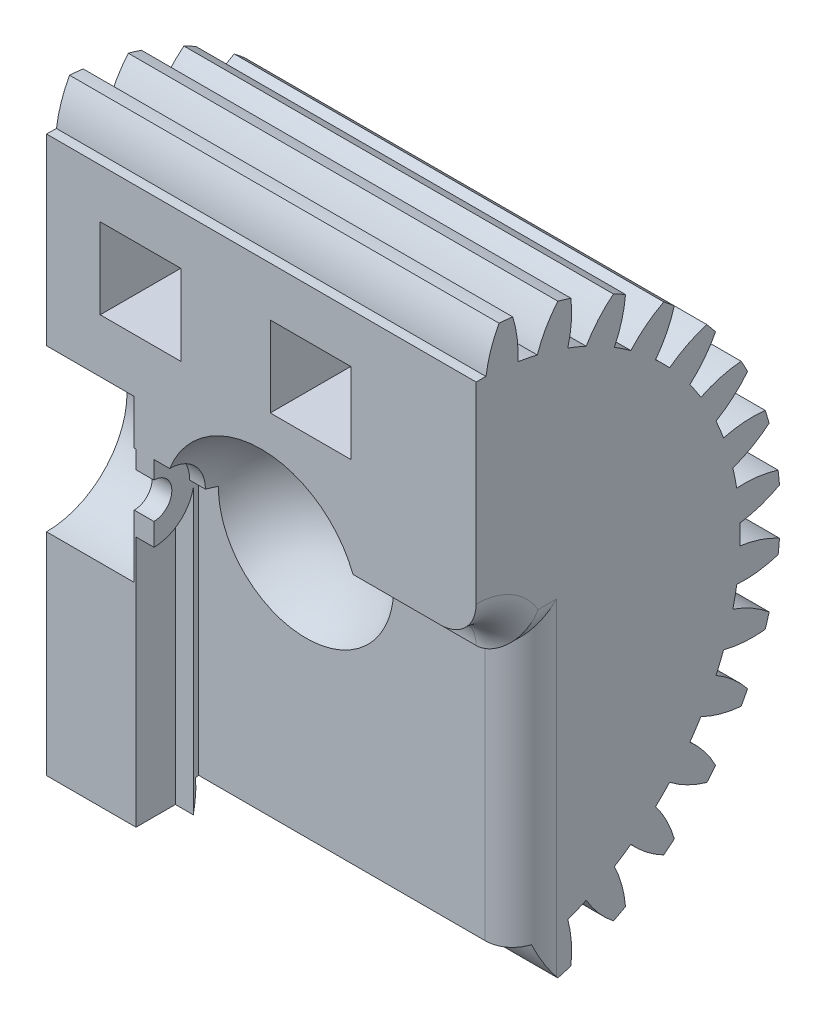
from build123d import *

# Parameters (mm, degrees)
BASPROSKE_W         = 10
BASPROSKE_H         = 8.5
TOOTHCUT_DEPTH      = 16.636495771
TEETHCUTS_COUNT     = 32
TEETHCUTS_ANGLE     = 348.75
BORSKE_R            = 1
BORE_DEPTH          = 50.0000508
SKETCH1_W           = 2.2
SKETCH1_H           = 12
CUT_EXTRUDE1_DEPTH  = 16.610070769
SKETCH4_R           = 1.125
SKETCH4_R_2         = 0.5
BOSS_EXTRUDE1_DEPTH = 0.5
BOSS_EXTRUDE2_REACH = 18.234
SKETCH5_W           = 2.5
SKETCH5_H           = 8.148803967
SKETCH6_R           = 2.25
CUT_EXTRUDE4_DEPTH  = 2.45
SKETCH7_R           = 0.5
CUT_EXTRUDE5_DEPTH  = 2.4
SKETCH8_W           = 11.062945953
SKETCH8_H           = 17.798852561
CUT_EXTRUDE7_DEPTH  = 10
SKETCH9_W           = 2.25
SKETCH9_H           = 2.25
CUT_EXTRUDE8_DEPTH  = 2.25
SKETCH10_W          = 1.25
SKETCH10_H          = 9
CUT_EXTRUDE10_DEPTH = 7
BOSS_EXTRUDE3_REACH = 18.961
FILLET1_R           = 1


with BuildPart() as part:
    # BasProSke → Base-Revolve (revolve)
    with BuildSketch(Plane(origin=(0, 0, 0), x_dir=(1, 0, 0), z_dir=(0, 1, 0))):
        with Locations((5, 4.25)):
            Rectangle(BASPROSKE_W, BASPROSKE_H)
    revolve(axis=Axis((-10, 0, 0), (1, 0, 0)))

    # TooCutSke → ToothCut (cut, through all)
    with BuildSketch(Plane(origin=(0, 0, 0), x_dir=(0, 0, -1), z_dir=(1, 0, 0))):
        with BuildLine():
            ThreePointArc((0.277002447, 7.3687954), (0, 7.374), (-0.277002447, 7.3687954))
            ThreePointArc((-0.277002447, 7.3687954), (-0.41335061, 7.952280695), (-0.656086882, 8.500117362))
            ThreePointArc((-0.656086882, 8.500117362), (0, 8.5254), (0.656086882, 8.500117362))
            ThreePointArc((0.656086882, 8.500117362), (0.41335061, 7.952280695), (0.277002447, 7.3687954))
        make_face()
    toothcut = extrude(amount=TOOTHCUT_DEPTH, mode=Mode.SUBTRACT)

    # TeethCuts: ToothCut ×32 about axis
    teethcuts_axis = Axis((-10, 0, 0), (1, 0, 0))
    for i in range(1, TEETHCUTS_COUNT):
        add(toothcut.rotate(teethcuts_axis, i * TEETHCUTS_ANGLE / (TEETHCUTS_COUNT - 1)), mode=Mode.SUBTRACT)

    # BorSke → Bore (cut, symmetric)
    with BuildSketch(Plane(origin=(0, 0, 0), x_dir=(0, 0, -1), z_dir=(1, 0, 0))):
        Circle(BORSKE_R)
    extrude(amount=BORE_DEPTH, both=True, mode=Mode.SUBTRACT)

    # Sketch1 → Cut-Extrude1 (cut, through all)
    with BuildSketch(Plane(origin=(10, 0, 0), x_dir=(0, 0, -1), z_dir=(1, 0, 0))):
        with Locations((0, -6)):
            Rectangle(SKETCH1_W, SKETCH1_H)
    extrude(amount=-CUT_EXTRUDE1_DEPTH, mode=Mode.SUBTRACT)

    # Sketch2 → Cut-Revolve1 (revolve, cut)
    with BuildSketch(Plane.XY):
        with BuildLine():
            Line((3.25, 0), (8.75, 0))
            ThreePointArc((8.75, 0), (6, 2.75), (3.25, 0))
        make_face()
    revolve(axis=Axis((3.25, 0, 0), (1, 0, 0)), mode=Mode.SUBTRACT)

    # Sketch4 → Boss-Extrude1 (add)
    with BuildSketch(Plane.ZY.offset(-3)):
        Circle(SKETCH4_R)
        Circle(SKETCH4_R_2, mode=Mode.SUBTRACT)
    extrude(amount=BOSS_EXTRUDE1_DEPTH)

    # Sketch5 → Boss-Extrude2 (add, up to next)
    with BuildSketch(Plane.XY.offset(-1.1), mode=Mode.PRIVATE) as boss_extrude2_sk1:
        with Locations((1.25, -4.074401984)):
            Rectangle(SKETCH5_W, SKETCH5_H)
    boss_extrude2_tool1 = extrude(boss_extrude2_sk1.sketch, amount=BOSS_EXTRUDE2_REACH, mode=Mode.PRIVATE) - part.part
    add(boss_extrude2_tool1.solids().sort_by_distance((1.25, -4.074402, -1.1))[0])

    # Sketch6 → Cut-Extrude4 (cut)
    with BuildSketch(Plane.ZY):
        Circle(SKETCH6_R)
    extrude(amount=-CUT_EXTRUDE4_DEPTH, mode=Mode.SUBTRACT)

    # Sketch7 → Cut-Extrude5 (cut)
    with BuildSketch(Plane(origin=(2.5, 0, 0), x_dir=(0, 0, -1), z_dir=(1, 0, 0))):
        Circle(SKETCH7_R)
    extrude(amount=-CUT_EXTRUDE5_DEPTH, mode=Mode.SUBTRACT)

    # Sketch8 → Cut-Extrude7 (cut)
    with BuildSketch(Plane.XY):
        with Locations((5.022304327, 0.010278679)):
            Rectangle(SKETCH8_W, SKETCH8_H)
    extrude(amount=CUT_EXTRUDE7_DEPTH, mode=Mode.SUBTRACT)

    # Sketch9 → Cut-Extrude8 (cut)
    with BuildSketch(Plane.XY):
        with Locations((2.625, 4.875)):
            Rectangle(SKETCH9_W, SKETCH9_H)
        with Locations((7.375, 4.875)):
            Rectangle(SKETCH9_W, SKETCH9_H)
    extrude(amount=-CUT_EXTRUDE8_DEPTH, mode=Mode.SUBTRACT)

    # Sketch10 → Cut-Extrude10 (cut)
    with BuildSketch(Plane(origin=(10, 0, 0), x_dir=(0, 0, -1), z_dir=(1, 0, 0))):
        with Locations((0.625, -4.5)):
            Rectangle(SKETCH10_W, SKETCH10_H)
    extrude(amount=-CUT_EXTRUDE10_DEPTH, mode=Mode.SUBTRACT)

    # Sketch11 → Boss-Extrude3 (add, up to next)
    with BuildSketch(Plane(origin=(12, 0, 0), x_dir=(0, 0, -1), z_dir=(1, 0, 0)), mode=Mode.PRIVATE) as boss_extrude3_sk1:
        with BuildLine():
            Line((0, 1), (0, 7.374))
            ThreePointArc((0, 7.374), (0.138525669, 7.372698735), (0.277002447, 7.3687954))
            ThreePointArc((0.277002447, 7.3687954), (0.408940123, 7.939022225), (0.642530382, 8.475680191))
            ThreePointArc((0.642530382, 8.475680191), (0.833145693, 8.459070177), (1.023338837, 8.438173832))
            ThreePointArc((1.023338837, 8.438173832), (1.14774395, 7.866256399), (1.165900745, 7.281246559))
            ThreePointArc((1.165900745, 7.281246559), (1.438596035, 7.232310658), (1.70926059, 7.173165566))
            ThreePointArc((1.70926059, 7.173165566), (1.949908855, 7.706695879), (2.283707519, 8.187470914))
            ThreePointArc((2.283707519, 8.187470914), (2.467419757, 8.133992854), (2.649881718, 8.076393185))
            ThreePointArc((2.649881718, 8.076393185), (2.660320865, 7.491194752), (2.563999025, 6.913883496))
            ThreePointArc((2.563999025, 6.913883496), (2.82190763, 6.812687673), (3.075832807, 6.701875002))
            ThreePointArc((3.075832807, 6.701875002), (3.415943684, 7.178205532), (3.837123056, 7.584621721))
            ThreePointArc((3.837123056, 7.584621721), (4.006872263, 7.496330747), (4.174591131, 7.404241277))
            ThreePointArc((4.174591131, 7.404241277), (4.070663142, 6.828250691), (3.86356426, 6.280823768))
            ThreePointArc((3.86356426, 6.280823768), (4.096774898, 6.131256921), (4.324202495, 5.97303514))
            ThreePointArc((4.324202495, 5.97303514), (4.750705713, 6.373860772), (5.243080107, 6.690299769))
            ThreePointArc((5.243080107, 6.690299769), (5.392342915, 6.570588854), (5.538873348, 6.447548529))
            ThreePointArc((5.538873348, 6.447548529), (5.324572118, 5.902900785), (5.014654888, 5.406395505))
            ThreePointArc((5.014654888, 5.406395505), (5.214205404, 5.214205404), (5.406395505, 5.014654888))
            ThreePointArc((5.406395505, 5.014654888), (5.902900785, 5.324572118), (6.447548529, 5.538873348))
            ThreePointArc((6.447548529, 5.538873348), (6.570588854, 5.392342915), (6.690299769, 5.243080107))
            ThreePointArc((6.690299769, 5.243080107), (6.373860772, 4.750705713), (5.97303514, 4.324202495))
            ThreePointArc((5.97303514, 4.324202495), (6.131256921, 4.096774898), (6.280823768, 3.86356426))
            ThreePointArc((6.280823768, 3.86356426), (6.828250691, 4.070663142), (7.404241277, 4.174591131))
            ThreePointArc((7.404241277, 4.174591131), (7.496330747, 4.006872263), (7.584621721, 3.837123056))
            ThreePointArc((7.584621721, 3.837123056), (7.178205532, 3.415943684), (6.701875002, 3.075832807))
            ThreePointArc((6.701875002, 3.075832807), (6.812687673, 2.82190763), (6.913883496, 2.563999025))
            ThreePointArc((6.913883496, 2.563999025), (7.491194752, 2.660320865), (8.076393185, 2.649881718))
            ThreePointArc((8.076393185, 2.649881718), (8.133992854, 2.467419757), (8.187470914, 2.283707519))
            ThreePointArc((8.187470914, 2.283707519), (7.706695879, 1.949908855), (7.173165566, 1.70926059))
            ThreePointArc((7.173165566, 1.70926059), (7.232310658, 1.438596035), (7.281246559, 1.165900745))
            ThreePointArc((7.281246559, 1.165900745), (7.866256399, 1.14774395), (8.438173832, 1.023338837))
            ThreePointArc((8.438173832, 1.023338837), (8.459070177, 0.833145693), (8.475680191, 0.642530382))
            ThreePointArc((8.475680191, 0.642530382), (7.939022225, 0.408940123), (7.3687954, 0.277002447))
            ThreePointArc((7.3687954, 0.277002447), (7.374, 0), (7.3687954, -0.277002447))
            ThreePointArc((7.3687954, -0.277002447), (7.939022225, -0.408940123), (8.475680191, -0.642530382))
            ThreePointArc((8.475680191, -0.642530382), (8.459070177, -0.833145693), (8.438173832, -1.023338837))
            ThreePointArc((8.438173832, -1.023338837), (7.866256399, -1.14774395), (7.281246559, -1.165900745))
            ThreePointArc((7.281246559, -1.165900745), (7.232310658, -1.438596035), (7.173165566, -1.70926059))
            ThreePointArc((7.173165566, -1.70926059), (7.706695879, -1.949908855), (8.187470914, -2.283707519))
            ThreePointArc((8.187470914, -2.283707519), (8.133992854, -2.467419757), (8.076393185, -2.649881718))
            ThreePointArc((8.076393185, -2.649881718), (7.491194752, -2.660320865), (6.913883496, -2.563999025))
            ThreePointArc((6.913883496, -2.563999025), (6.812687673, -2.82190763), (6.701875002, -3.075832807))
            ThreePointArc((6.701875002, -3.075832807), (7.178205532, -3.415943684), (7.584621721, -3.837123056))
            ThreePointArc((7.584621721, -3.837123056), (7.496330747, -4.006872263), (7.404241277, -4.174591131))
            ThreePointArc((7.404241277, -4.174591131), (6.828250691, -4.070663142), (6.280823768, -3.86356426))
            ThreePointArc((6.280823768, -3.86356426), (6.131256921, -4.096774898), (5.97303514, -4.324202495))
            ThreePointArc((5.97303514, -4.324202495), (6.373860772, -4.750705713), (6.690299769, -5.243080107))
            ThreePointArc((6.690299769, -5.243080107), (6.570588854, -5.392342915), (6.447548529, -5.538873348))
            ThreePointArc((6.447548529, -5.538873348), (5.902900785, -5.324572118), (5.406395505, -5.014654888))
            ThreePointArc((5.406395505, -5.014654888), (5.214205404, -5.214205404), (5.014654888, -5.406395505))
            ThreePointArc((5.014654888, -5.406395505), (5.324572118, -5.902900785), (5.538873348, -6.447548529))
            ThreePointArc((5.538873348, -6.447548529), (5.392342915, -6.570588854), (5.243080107, -6.690299769))
            ThreePointArc((5.243080107, -6.690299769), (4.750705713, -6.373860772), (4.324202495, -5.97303514))
            ThreePointArc((4.324202495, -5.97303514), (4.096774898, -6.131256921), (3.86356426, -6.280823768))
            ThreePointArc((3.86356426, -6.280823768), (4.070663142, -6.828250691), (4.174591131, -7.404241277))
            ThreePointArc((4.174591131, -7.404241277), (4.006872263, -7.496330747), (3.837123056, -7.584621721))
            ThreePointArc((3.837123056, -7.584621721), (3.415943684, -7.178205532), (3.075832807, -6.701875002))
            ThreePointArc((3.075832807, -6.701875002), (2.82190763, -6.812687673), (2.563999025, -6.913883496))
            ThreePointArc((2.563999025, -6.913883496), (2.660320865, -7.491194752), (2.649881718, -8.076393185))
            ThreePointArc((2.649881718, -8.076393185), (2.467419757, -8.133992854), (2.283707519, -8.187470914))
            ThreePointArc((2.283707519, -8.187470914), (1.949908855, -7.706695879), (1.70926059, -7.173165566))
            ThreePointArc((1.70926059, -7.173165566), (1.480378414, -7.223874013), (1.25, -7.267281197))
            Line((1.25, -7.267281197), (1.25, 0))
            Line((1.25, 0), (1, 0))
            ThreePointArc((1, 0), (0.707106781, 0.707106781), (0, 1))
        make_face()
    boss_extrude3_tool1 = extrude(boss_extrude3_sk1.sketch, amount=-BOSS_EXTRUDE3_REACH, mode=Mode.PRIVATE) - part.part
    add(boss_extrude3_tool1.solids().sort_by_distance((12, 0.4527, -3.714882))[0])

    # Fillet1
    fillet1_edges = [part.edges().sort_by_distance(p)[0] for p in [
        (12, 0, -1.125),
        (12, 0.707106781, -0.707106781),
        (12, -3.633640599, -1.25),
    ]]
    fillet(fillet1_edges, radius=FILLET1_R)


solid = part.part
